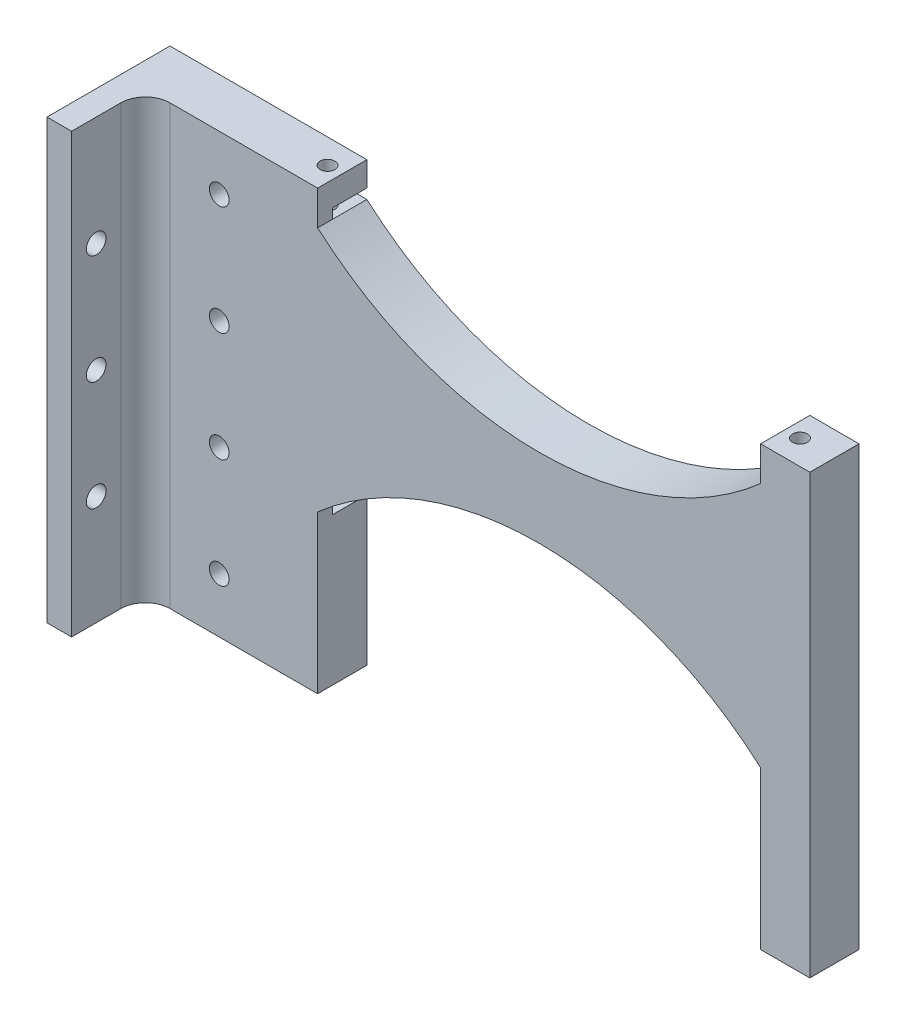
from build123d import *

# Parameters (mm, degrees)
BOSS_EXTRUDE1_DEPTH     = 10
CUT_EXTRUDE1_DEPTH      = 72.414284285
CUT_EXTRUDE1_DEPTH_BACK = 72.414284285
SKETCH2_R               = 1.5
SKETCH9_W               = 10
SKETCH9_H               = 50
BOSS_EXTRUDE9_DEPTH     = 5
SKETCH10_W              = 10
SKETCH10_H              = 50
BOSS_EXTRUDE10_DEPTH    = 5
BOSS_EXTRUDE11_DEPTH    = 2
SKETCH12_W              = 10
SKETCH12_H              = 10
BOSS_EXTRUDE12_DEPTH    = 5
CUT_EXTRUDE2_START      = 7
SKETCH13_R              = 1.5
CUT_EXTRUDE2_DEPTH      = 7
BOSS_EXTRUDE13_DEPTH    = 2
SKETCH15_W              = 9.981523119
SKETCH15_H              = 10
BOSS_EXTRUDE14_DEPTH    = 30
SKETCH16_R              = 1.5
CUT_EXTRUDE3_DEPTH      = 32
SKETCH17_W              = 10
SKETCH17_H              = 89
BOSS_EXTRUDE15_DEPTH    = 30
SKETCH19_W              = 5
SKETCH19_H              = 89
BOSS_EXTRUDE16_DEPTH    = 15
FILLET1_R               = 5
SKETCH20_R              = 2
CUT_EXTRUDE4_DEPTH      = 149.657324071
SKETCH21_R              = 2
CUT_EXTRUDE5_DEPTH      = 10


with BuildPart() as part:
    # Sketch1 → Boss-Extrude1 (new body)
    with BuildSketch(Plane.XY):
        with BuildLine():
            Line((45.018476881, -25), (50, -25))
            Line((50, -25), (50, 25))
            Line((50, 25), (45, 25))
            ThreePointArc((45, 25), (0, 8), (-45, 25))
            Line((-45, 25), (-50, 25))
            Line((-50, 25), (-50, -25))
            Line((-50, -25), (-45.018476881, -25))
            ThreePointArc((-45.018476881, -25), (0, -8), (45.018476881, -25))
        make_face()
    extrude(amount=BOSS_EXTRUDE1_DEPTH)

    # Sketch2 → Cut-Extrude1 (cut, two sides: drawn at the far end of the back side and taken through both)
    with BuildSketch(Plane(origin=(0, 25, 0), x_dir=(1, 0, 0), z_dir=(0, 1, 0)).offset(-CUT_EXTRUDE1_DEPTH_BACK)):
        with Locations(Location((-48, -5, 0), (0, 0, 180))):
            Circle(SKETCH2_R)
        with Locations(Location((48, -5, 0), (0, 0, 180))):
            Circle(SKETCH2_R)
    extrude(amount=CUT_EXTRUDE1_DEPTH + CUT_EXTRUDE1_DEPTH_BACK, mode=Mode.SUBTRACT)

    # Sketch9 → Boss-Extrude9 (add)
    with BuildSketch(Plane(origin=(50, 0, 0), x_dir=(0, 0, -1), z_dir=(1, 0, 0))):
        with Locations((-5, 0)):
            Rectangle(SKETCH9_W, SKETCH9_H)
    extrude(amount=BOSS_EXTRUDE9_DEPTH)

    # Sketch10 → Boss-Extrude10 (add)
    with BuildSketch(Plane.ZY.offset(50)):
        with Locations((5, 0)):
            Rectangle(SKETCH10_W, SKETCH10_H)
    extrude(amount=BOSS_EXTRUDE10_DEPTH)

    # Sketch11 → Boss-Extrude11 (add)
    with BuildSketch(Plane(origin=(0, 25, 0), x_dir=(1, 0, 0), z_dir=(0, 1, 0))):
        Polygon((50, 0), (50, -7), (45, -7), (45, -10), (55, -10), (55, 0), align=None)
        Polygon((-50, 0), (-50, -7), (-45, -7), (-45, -10), (-55, -10), (-55, 0), align=None)
    extrude(amount=BOSS_EXTRUDE11_DEPTH)

    # Sketch12 → Boss-Extrude12 (add)
    with BuildSketch(Plane(origin=(0, 27, 0), x_dir=(1, 0, 0), z_dir=(0, 1, 0))):
        with Locations((50, -5)):
            Rectangle(SKETCH12_W, SKETCH12_H)
        with Locations((-50, -5)):
            Rectangle(SKETCH12_W, SKETCH12_H)
    extrude(amount=BOSS_EXTRUDE12_DEPTH)

    # Sketch13 → Cut-Extrude2 (cut)
    with BuildSketch(Plane(origin=(0, 25, 0), x_dir=(1, 0, 0), z_dir=(0, 1, 0)).offset(CUT_EXTRUDE2_START)):
        with Locations(Location((48, -5, 0), (0, 0, 180))):
            Circle(SKETCH13_R)
        with Locations(Location((-48, -5, 0), (0, 0, 180))):
            Circle(SKETCH13_R)
    extrude(amount=-CUT_EXTRUDE2_DEPTH, mode=Mode.SUBTRACT)

    # Sketch14 → Boss-Extrude13 (add)
    with BuildSketch(Plane.XZ.offset(25)):
        Polygon((50.009238441, 0), (50.009238441, 7), (45.018476881, 7), (45.018476881, 10), (55, 10), (55, 0), align=None)
        Polygon((-50.009238441, 0), (-50.009238441, 7), (-45.018476881, 7), (-45.018476881, 10), (-55, 10), (-55, 0), align=None)
    extrude(amount=BOSS_EXTRUDE13_DEPTH)

    # Sketch15 → Boss-Extrude14 (add)
    with BuildSketch(Plane.XZ.offset(27)):
        with Locations((-50.00923844, 5)):
            Rectangle(SKETCH15_W, SKETCH15_H)
        with Locations((50.00923844, 5)):
            Rectangle(SKETCH15_W, SKETCH15_H)
    extrude(amount=BOSS_EXTRUDE14_DEPTH)

    # Sketch16 → Cut-Extrude3 (cut)
    with BuildSketch(Plane.XZ.offset(25)):
        with Locations(Location((48, 5, 0), (0, 0, 180))):
            Circle(SKETCH16_R)
        with Locations(Location((-48, 5, 0), (0, 0, 180))):
            Circle(SKETCH16_R)
    extrude(amount=CUT_EXTRUDE3_DEPTH, mode=Mode.SUBTRACT)

    # Sketch17 → Boss-Extrude15 (add)
    with BuildSketch(Plane.ZY.offset(55)):
        with Locations((5, -12.5)):
            Rectangle(SKETCH17_W, SKETCH17_H)
    extrude(amount=BOSS_EXTRUDE15_DEPTH)

    # Sketch19 → Boss-Extrude16 (add)
    with BuildSketch(Plane.XY.offset(10)):
        with Locations((-82.5, -12.5)):
            Rectangle(SKETCH19_W, SKETCH19_H)
    extrude(amount=BOSS_EXTRUDE16_DEPTH)

    # Fillet1
    fillet1_edges = [part.edges().sort_by_distance(p)[0] for p in [
        (-80, -12.5, 10),
    ]]
    fillet(fillet1_edges, radius=FILLET1_R)

    # Sketch20 → Cut-Extrude4 (cut, through all)
    with BuildSketch(Plane(origin=(-80, 0, 0), x_dir=(0, 0, -1), z_dir=(1, 0, 0))):
        with Locations(Location((-20, 9.75, 0), (0, 0, 90))):
            Circle(SKETCH20_R)
        with Locations(Location((-20, -12.5, 0), (0, 0, 90))):
            Circle(SKETCH20_R)
        with Locations(Location((-20, -34.75, 0), (0, 0, 90))):
            Circle(SKETCH20_R)
    extrude(amount=-CUT_EXTRUDE4_DEPTH, mode=Mode.SUBTRACT)

    # Sketch21 → Cut-Extrude5 (cut)
    with BuildSketch(Plane.XY.offset(10)):
        with Locations((-65, 20.875)):
            Circle(SKETCH21_R)
        with Locations((-65, -1.375)):
            Circle(SKETCH21_R)
        with Locations((-65, -23.625)):
            Circle(SKETCH21_R)
        with Locations((-65, -45.875)):
            Circle(SKETCH21_R)
    extrude(amount=-CUT_EXTRUDE5_DEPTH, mode=Mode.SUBTRACT)


solid = part.part
